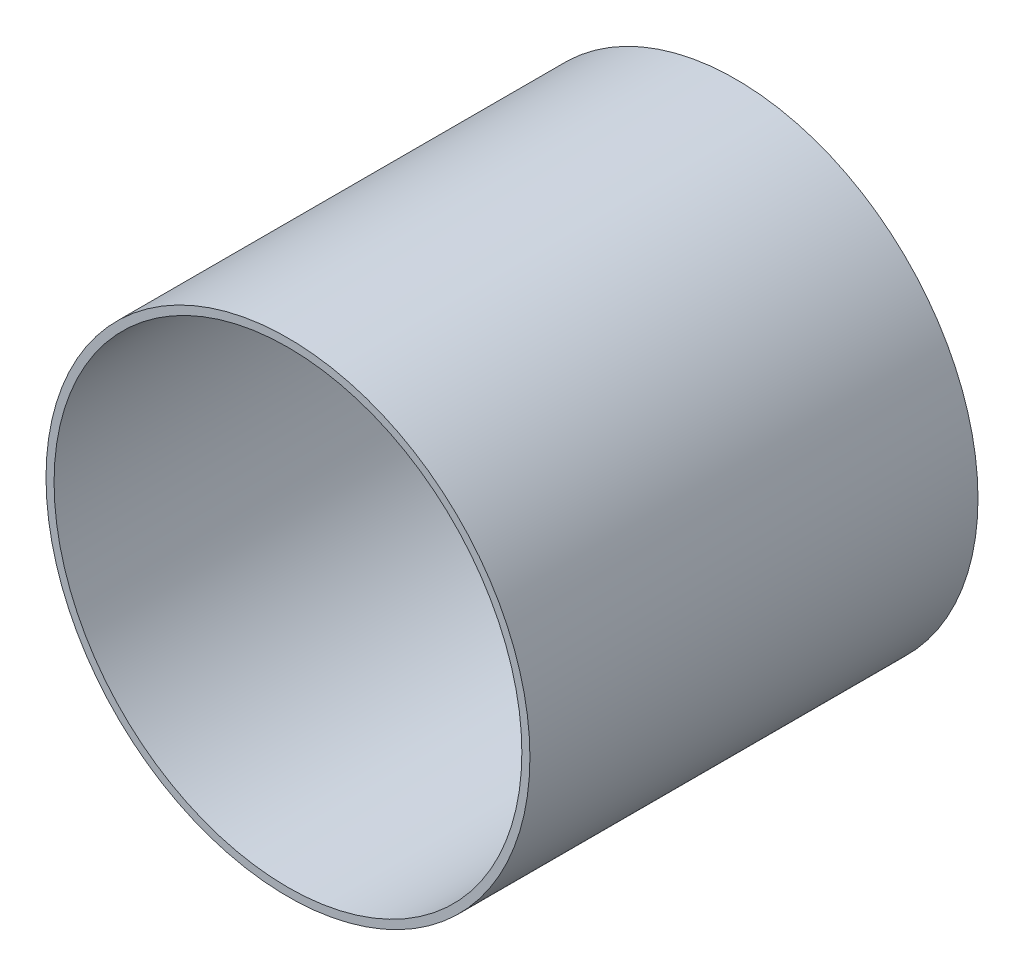
from build123d import *

# Parameters (mm, degrees)
SKETCH1_R           = 13.5
SKETCH1_R_2         = 13.05
BOSS_EXTRUDE1_DEPTH = 25


with BuildPart() as part:
    # Sketch1 → Boss-Extrude1 (new body)
    with BuildSketch(Plane.XY):
        Circle(SKETCH1_R)
        Circle(SKETCH1_R_2, mode=Mode.SUBTRACT)
    extrude(amount=BOSS_EXTRUDE1_DEPTH)


solid = part.part
